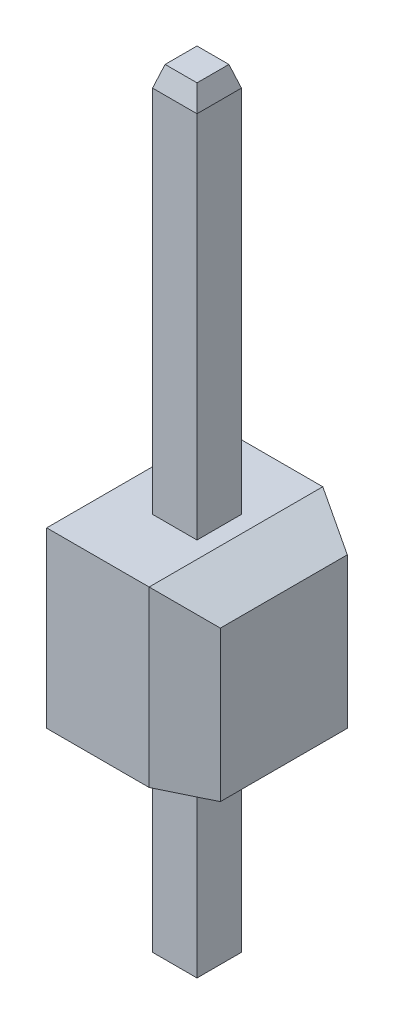
from build123d import *
from OCP.BRepFilletAPI import BRepFilletAPI_MakeChamfer

# Parameters (mm, degrees)
SKETCH1_W           = 2.54
SKETCH1_H           = 2.54
BOSS_EXTRUDE1_DEPTH = 2.54
SKETCH2_W           = 0.65
SKETCH2_H           = 0.65
BOSS_EXTRUDE2_DEPTH = 5.7
SKETCH3_W           = 0.65
SKETCH3_H           = 0.65
BOSS_EXTRUDE3_DEPTH = 3.1
CHAMFER1_SIZE       = 0.091719204
CHAMFER1_SIZE2      = 0.3
CHAMFER2_SIZE       = 0.3
CHAMFER2_SIZE2      = 0.091719204
CHAMFER3_SIZE       = 0.7
CHAMFER3_SIZE2      = 0.341412812


with BuildPart() as part:
    # Sketch1 → Boss-Extrude1 (new body)
    with BuildSketch(Plane(origin=(1.27, 0, 0), x_dir=(0, 0, -1), z_dir=(1, 0, 0))):
        with Locations((0, 1.27)):
            Rectangle(SKETCH1_W, SKETCH1_H)
    extrude(amount=-BOSS_EXTRUDE1_DEPTH)

    # Sketch2 → Boss-Extrude2 (add)
    with BuildSketch(Plane(origin=(0, 2.54, 0), x_dir=(-1, 0, 0), z_dir=(0, 1, 0))):
        Rectangle(SKETCH2_W, SKETCH2_H)
    extrude(amount=BOSS_EXTRUDE2_DEPTH)

    # Sketch3 → Boss-Extrude3 (add)
    with BuildSketch(Plane.XZ):
        Rectangle(SKETCH3_W, SKETCH3_H)
    extrude(amount=BOSS_EXTRUDE3_DEPTH)

    # Chamfer1
    chamfer1_edges = [part.edges().sort_by_distance(p)[0] for p in [
        (0.325, 8.24, 0),
        (0, 8.24, -0.325),
        (-0.325, 8.24, 0),
        (0, 8.24, 0.325),
    ]]
    chamfer1_side = [part.faces().sort_by_distance(p)[0] for p in [
        (0, 8.24, 0),
    ]]
    chamfer(chamfer1_edges, length=CHAMFER1_SIZE, length2=CHAMFER1_SIZE2, reference=chamfer1_side[0])

    # Chamfer2
    chamfer2_edges = [part.edges().sort_by_distance(p)[0] for p in [
        (0, -3.1, -0.325),
        (0.325, -3.1, 0),
        (0, -3.1, 0.325),
        (-0.325, -3.1, 0),
    ]]
    chamfer2_side = [part.faces().sort_by_distance(p)[0] for p in [
        (0, -3.1, 0),
    ]]
    chamfer(chamfer2_edges, length=CHAMFER2_SIZE, length2=CHAMFER2_SIZE2, reference=chamfer2_side[0])

    # Chamfer3: one chamfer whose edges measure the first distance from different faces: ONE call of the kernel's chamfer builder (chamfer() names one face for all edges)
    chamfer3_edges_1 = [part.edges().sort_by_distance(p)[0] for p in [
        (-1.27, 1.27, -1.27),
        (-1.27, 2.54, 0),
        (-1.27, 1.27, 1.27),
    ]]
    chamfer3_side_1 = [part.faces().sort_by_distance(p)[0] for p in [
        (-1.27, 1.27, 0),
    ]]
    chamfer3_edges_2 = [part.edges().sort_by_distance(p)[0] for p in [
        (1.27, 2.54, 0),
    ]]
    chamfer3_side_2 = [part.faces().sort_by_distance(p)[0] for p in [
        (0, 2.54, -1.234078976),
    ]]
    chamfer3_edges_3 = [part.edges().sort_by_distance(p)[0] for p in [
        (1.27, 1.27, -1.27),
    ]]
    chamfer3_side_3 = [part.faces().sort_by_distance(p)[0] for p in [
        (0, 1.27, -1.27),
    ]]
    chamfer3_edges_4 = [part.edges().sort_by_distance(p)[0] for p in [
        (1.27, 1.27, 1.27),
    ]]
    chamfer3_side_4 = [part.faces().sort_by_distance(p)[0] for p in [
        (0, 1.27, 1.27),
    ]]
    chamfer3 = BRepFilletAPI_MakeChamfer(part.part.solid().wrapped)
    for e in chamfer3_edges_1:
        chamfer3.Add(CHAMFER3_SIZE, CHAMFER3_SIZE2, e.wrapped, chamfer3_side_1[0].wrapped)  # the first distance lies on this face
    for e in chamfer3_edges_2:
        chamfer3.Add(CHAMFER3_SIZE, CHAMFER3_SIZE2, e.wrapped, chamfer3_side_2[0].wrapped)  # the first distance lies on this face
    for e in chamfer3_edges_3:
        chamfer3.Add(CHAMFER3_SIZE, CHAMFER3_SIZE2, e.wrapped, chamfer3_side_3[0].wrapped)  # the first distance lies on this face
    for e in chamfer3_edges_4:
        chamfer3.Add(CHAMFER3_SIZE, CHAMFER3_SIZE2, e.wrapped, chamfer3_side_4[0].wrapped)  # the first distance lies on this face
    add(Compound.cast(chamfer3.Shape()), mode=Mode.REPLACE)


solid = part.part
